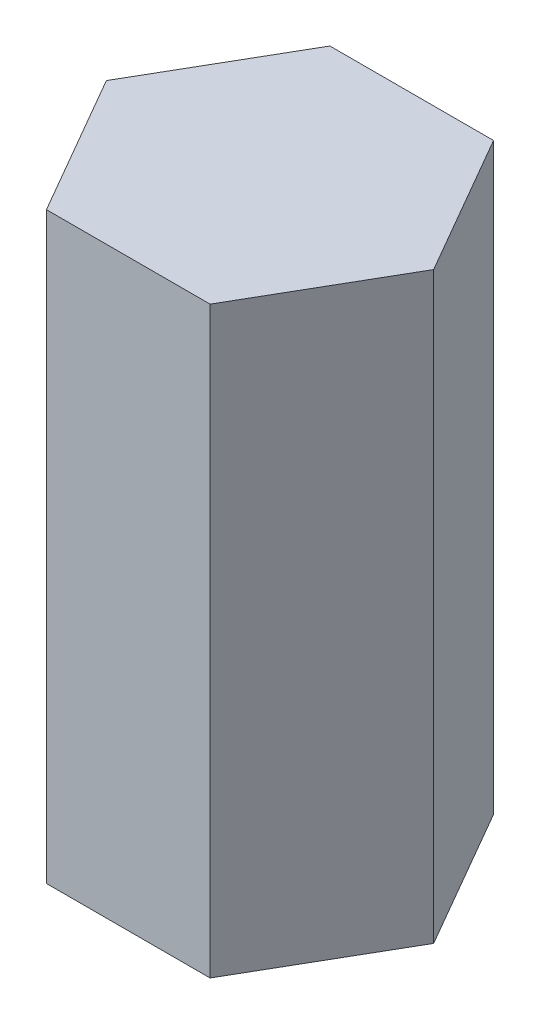
from build123d import *

# Parameters (mm, degrees)
DODANIE_WYCI_GNI_CIE1_DEPTH = 35


with BuildPart() as part:
    # Szkic1 → Dodanie-wyciągnięcie1 (new body)
    with BuildSketch(Plane(origin=(0, 0, 0), x_dir=(1, 0, 0), z_dir=(0, 1, 0))):
        Polygon((9.814954576, 0), (4.907477288, 8.5), (-4.907477288, 8.5), (-9.814954576, 0), (-4.907477288, -8.5), (4.907477288, -8.5), align=None)
    extrude(amount=DODANIE_WYCI_GNI_CIE1_DEPTH)


solid = part.part
